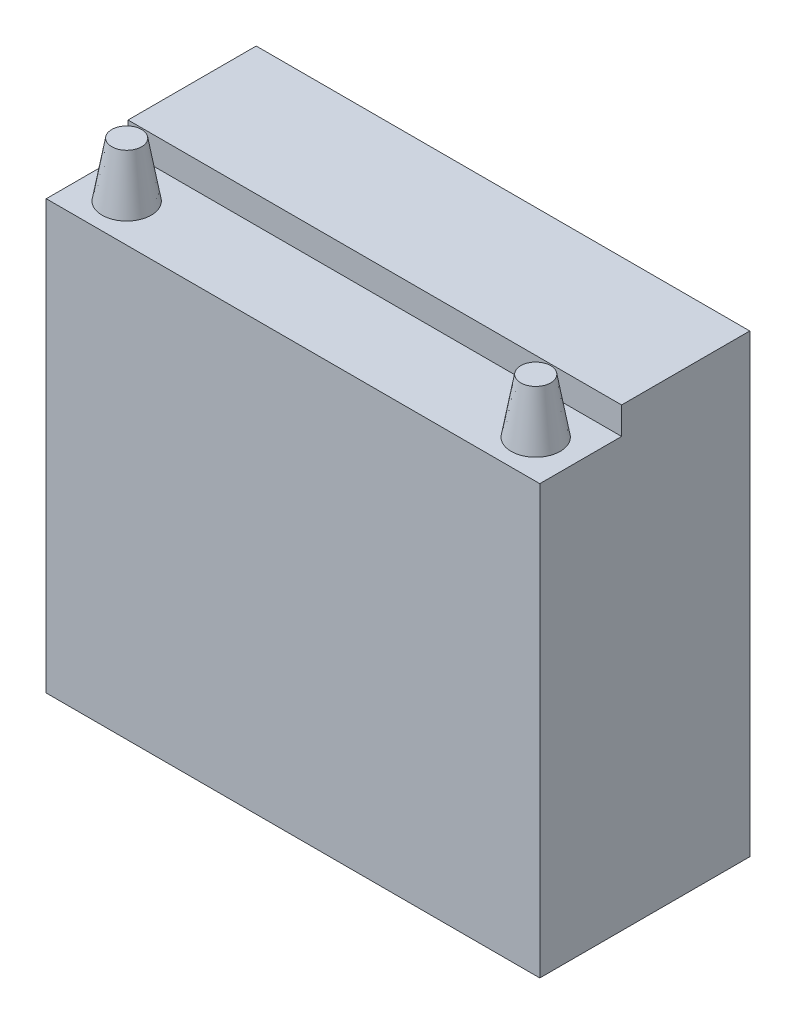
from build123d import *

# Parameters (mm, degrees)
ESBO_O1_W                = 181
ESBO_O1_H                = 167
RESSALTO_EXTRUS_O1_DEPTH = 77
ESBO_O2_W                = 30.000000008
ESBO_O2_H                = 10.00000002
CORTE_EXTRUS_O1_DEPTH    = 251.380240594


with BuildPart() as part:
    # Esboço1 → Ressalto-extrusão1 (new body)
    with BuildSketch(Plane(origin=(0, 0, -45.169291339), x_dir=(-1, 0, 0), z_dir=(0, 0, -1))):
        with Locations((-13.5, 83.5)):
            Rectangle(ESBO_O1_W, ESBO_O1_H)
    extrude(amount=-RESSALTO_EXTRUS_O1_DEPTH)

    # Esboço2 → Corte-extrusão1 (cut, through all)
    with BuildSketch(Plane.ZY.offset(77)):
        with Locations((16.830708657, 161.99999999)):
            Rectangle(ESBO_O2_W, ESBO_O2_H)
    extrude(amount=-CORTE_EXTRUS_O1_DEPTH, mode=Mode.SUBTRACT)

    # Esboço3 → Revolução1 (revolve)
    with BuildSketch(Plane(origin=(0, 0, 17.830708661), x_dir=(-1, 0, 0), z_dir=(0, 0, -1)), mode=Mode.PRIVATE) as revolu_o1_sk:
        Polygon((-97.5, 157), (-88.5, 157), (-88.5, 177), (-93.973460386, 177), align=None)
    revolve(revolu_o1_sk.sketch.rotate(Axis((88.5, 157, 17.830708661), (0, 1, 0)), 270), axis=Axis((88.5, 157, 17.830708661), (0, 1, 0)))

    # Esboço4 → Revolução2 (revolve)
    with BuildSketch(Plane(origin=(0, 0, 17.830708661), x_dir=(-1, 0, 0), z_dir=(0, 0, -1)), mode=Mode.PRIVATE) as revolu_o2_sk:
        Polygon((52.5, 157), (61.5, 157), (61.5, 177), (56.026539614, 177), align=None)
    revolve(revolu_o2_sk.sketch.rotate(Axis((-61.5, 157, 17.830708661), (0, 1, 0)), 270), axis=Axis((-61.5, 157, 17.830708661), (0, 1, 0)))


solid = part.part
